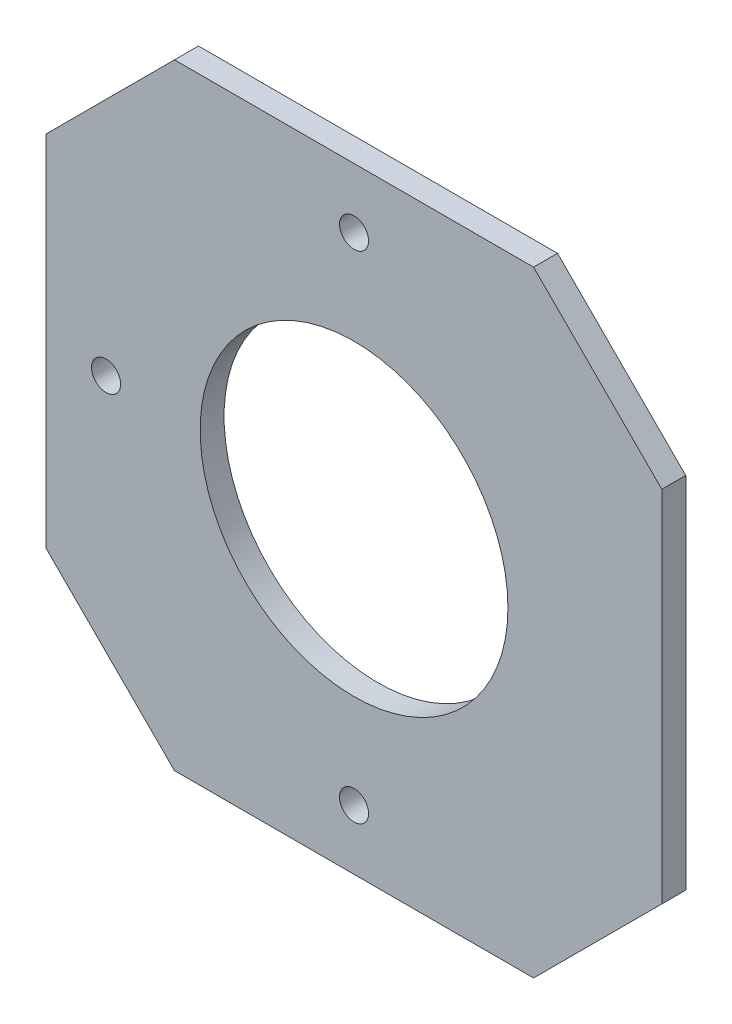
from build123d import *

# Parameters (mm, degrees)
SKETCH_1_R                  = 18
SKETCH_1_R_2                = 1.7
F_04_BEARING_RETAINER_DEPTH = 2.8


with BuildPart() as part:
    # Эскиз1 → 04_Bearing_retainer (new body)
    with BuildSketch(Plane.XY):
        Polygon((-21, -36), (21, -36), (36, -21), (36, 21), (21, 36), (-21, 36), (-36, 21), (-36, -21), align=None)
        Circle(SKETCH_1_R, mode=Mode.SUBTRACT)
        with Locations((0, 29)):
            Circle(SKETCH_1_R_2, mode=Mode.SUBTRACT)
        with Locations((0, -29)):
            Circle(SKETCH_1_R_2, mode=Mode.SUBTRACT)
        with Locations((-29, 0)):
            Circle(SKETCH_1_R_2, mode=Mode.SUBTRACT)
    extrude(amount=F_04_BEARING_RETAINER_DEPTH)


solid = part.part
